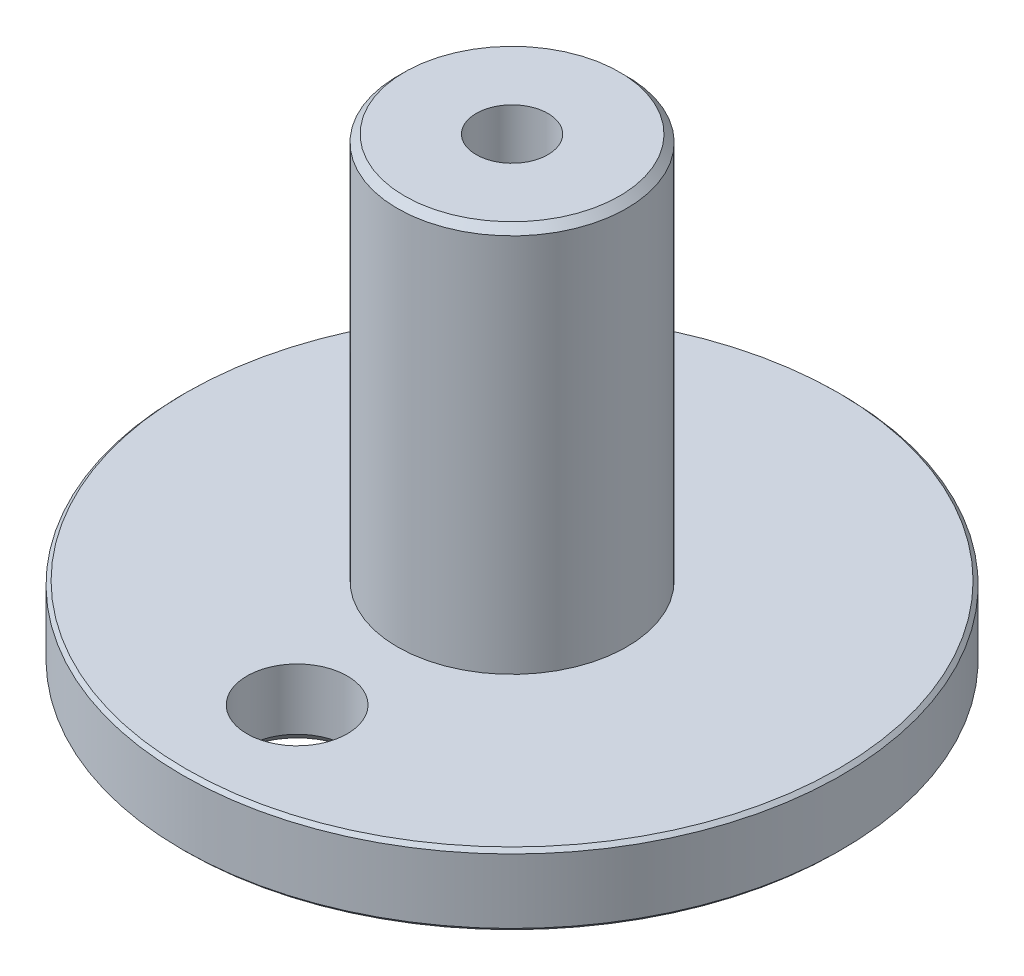
from build123d import *

# Parameters (mm, degrees)
SKETCH1_R           = 23
BOSS_EXTRUDE1_DEPTH = 32
SKETCH2_OUTSIDE_W   = 62.5
SKETCH2_OUTSIDE_H   = 62.5
SKETCH2_OUTSIDE_R   = 8
CUT_EXTRUDE1_DEPTH  = 27
SKETCH3_R           = 2.5
CUT_EXTRUDE2_DEPTH  = 46.628938186
CHAMFER1_SIZE       = 0.5
CHAMFER2_SIZE       = 0.25
SKETCH4_R           = 3.5
CUT_EXTRUDE3_DEPTH  = 46.628938186
CHAMFER3_SIZE       = 0.75


with BuildPart() as part:
    # Sketch1 → Boss-Extrude1 (new body)
    with BuildSketch(Plane(origin=(0, 0, 0), x_dir=(1, 0, 0), z_dir=(0, 1, 0))):
        with Locations(Location((0, 0, 0), (0, 0, 270))):
            Circle(SKETCH1_R)
    extrude(amount=BOSS_EXTRUDE1_DEPTH)

    # Sketch2 outside → Cut-Extrude1 (cut)
    with BuildSketch(Plane(origin=(0, 32, 0), x_dir=(1, 0, 0), z_dir=(0, 1, 0))):
        Rectangle(SKETCH2_OUTSIDE_W, SKETCH2_OUTSIDE_H)
        with Locations(Location((0, 0, 0), (0, 0, 270))):
            Circle(SKETCH2_OUTSIDE_R, mode=Mode.SUBTRACT)
    extrude(amount=-CUT_EXTRUDE1_DEPTH, mode=Mode.SUBTRACT)

    # Sketch3 → Cut-Extrude2 (cut, through all)
    with BuildSketch(Plane(origin=(0, 32, 0), x_dir=(1, 0, 0), z_dir=(0, 1, 0))):
        with Locations(Location((0, 0, 0), (0, 0, 270))):
            Circle(SKETCH3_R)
    extrude(amount=-CUT_EXTRUDE2_DEPTH, mode=Mode.SUBTRACT)

    # Chamfer1
    chamfer1_edges = [part.edges().sort_by_distance(p)[0] for p in [
        (0, 32, -8),
    ]]
    chamfer(chamfer1_edges, length=CHAMFER1_SIZE)

    # Chamfer2
    chamfer2_edges = [part.edges().sort_by_distance(p)[0] for p in [
        (0, 0, -23),
        (0, 5, -23),
    ]]
    chamfer(chamfer2_edges, length=CHAMFER2_SIZE)

    # Sketch4 → Cut-Extrude3 (cut, through all)
    with BuildSketch(Plane.XZ):
        with Locations(Location((0, 15, 0), (0, 0, 270))):
            Circle(SKETCH4_R)
    extrude(amount=-CUT_EXTRUDE3_DEPTH, mode=Mode.SUBTRACT)

    # Chamfer3
    chamfer3_edges = [part.edges().sort_by_distance(p)[0] for p in [
        (0, 0, 18.5),
    ]]
    chamfer(chamfer3_edges, length=CHAMFER3_SIZE)


solid = part.part
